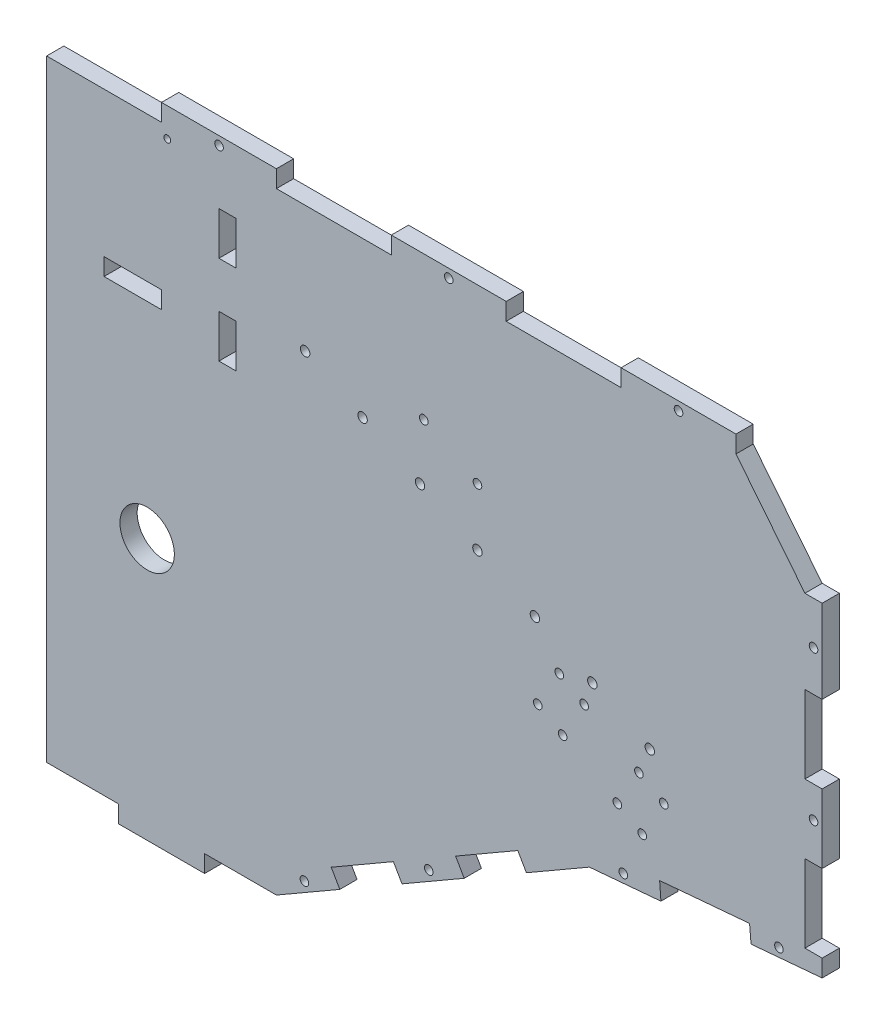
from build123d import *

# Parameters (mm, degrees)
ESQUISSE1_W                   = 270
ESQUISSE1_H                   = 213
BOSS_EXTRU_1_DEPTH            = 6
ESQUISSE3_R                   = 9.475
ESQUISSE3_R_2                 = 1.5
ENL_V_MAT_EXTRU_1_DEPTH       = 10
ENL_V_MAT_EXTRU_11_DEPTH      = 173.055950202
ENL_V_MAT_EXTRU_11_DEPTH_BACK = 173.055950202
ESQUISSE6_W                   = 40
ESQUISSE6_H                   = 6
BOSS_EXTRU_2_DEPTH            = 6
ESQUISSE7_W                   = 6
ESQUISSE7_H                   = 30
ESQUISSE7_H_2                 = 27
ENL_V_MAT_EXTRU_12_DEPTH      = 6
ESQUISSE8_W                   = 30
ESQUISSE8_H                   = 6
BOSS_EXTRU_3_DEPTH            = 6
ENL_V_MAT_EXTRU_13_DEPTH      = 176.833017377
ENL_V_MAT_EXTRU_14_DEPTH      = 10
ESQUISSE11_W                  = 6
ESQUISSE11_H                  = 15
ENL_V_MAT_EXTRU_15_DEPTH      = 176.833017377
ESQUISSE12_R                  = 1.65
ESQUISSE12_R_2                = 1.185214878
ESQUISSE12_R_3                = 1.5
ENL_V_MAT_EXTRU_16_DEPTH      = 176.833017377
ENL_V_MAT_EXTRU_17_DEPTH      = 176.833017377
ESQUISSE14_R                  = 4
ENL_V_MAT_EXTRU_18_DEPTH      = 1
ESQUISSE15_R                  = 2.995
ESQUISSE15_R_2                = 2.95
ENL_V_MAT_EXTRU_19_DEPTH      = 3
ESQUISSE16_R                  = 1.5
ENL_V_MAT_EXTRU_20_DEPTH      = 10
ESQUISSE17_W                  = 20
ESQUISSE17_H                  = 6
ENL_V_MAT_EXTRU_22_DEPTH      = 10


with BuildPart() as part:
    # Esquisse1 → Boss.-Extru.1 (new body)
    with BuildSketch(Plane.XY):
        Rectangle(ESQUISSE1_W, ESQUISSE1_H)
    extrude(amount=BOSS_EXTRU_1_DEPTH)

    # Esquisse3 → Enlèv. mat.-Extru.1 (cut)
    with BuildSketch(Plane.XY.offset(6)):
        with Locations((-100, -21.5)):
            Circle(ESQUISSE3_R)
        with Locations((43.489676576, 9.523710062)):
            Circle(ESQUISSE3_R_2)
        with Locations((52.149930614, 4.523710062)):
            Circle(ESQUISSE3_R_2)
        with Locations((35.989676576, -3.466670994)):
            Circle(ESQUISSE3_R_2)
        with Locations((44.649930614, -8.466670994)):
            Circle(ESQUISSE3_R_2)
        with Locations((63.702489497, -19.466670994)):
            Circle(ESQUISSE3_R_2)
        with Locations((72.362743535, -24.466670994)):
            Circle(ESQUISSE3_R_2)
        with Locations((79.862743535, -11.476289938)):
            Circle(ESQUISSE3_R_2)
        with Locations((71.202489497, -6.476289938)):
            Circle(ESQUISSE3_R_2)
    extrude(amount=-ENL_V_MAT_EXTRU_1_DEPTH, mode=Mode.SUBTRACT)

    # Esquisse5 → Enlèv. mat.-Extru.11 (cut, two sides: drawn at the far end of the back side and taken through both)
    with BuildSketch(Plane.XY.offset(6).offset(-ENL_V_MAT_EXTRU_11_DEPTH_BACK)):
        Polygon((135, -36.5), (53.963742643, -43.589753853), (-55, -106.5), (135, -106.5), align=None)
    extrude(amount=ENL_V_MAT_EXTRU_11_DEPTH + ENL_V_MAT_EXTRU_11_DEPTH_BACK, mode=Mode.SUBTRACT)

    # Esquisse6 → Boss.-Extru.2 (add)
    with BuildSketch(Plane(origin=(0, 106.5, 0), x_dir=(1, 0, 0), z_dir=(0, 1, 0))):
        with Locations((-75, -3)):
            Rectangle(ESQUISSE6_W, ESQUISSE6_H)
        with Locations((5, -3)):
            Rectangle(ESQUISSE6_W, ESQUISSE6_H)
        with Locations((85, -3)):
            Rectangle(ESQUISSE6_W, ESQUISSE6_H)
    extrude(amount=BOSS_EXTRU_2_DEPTH)

    # Esquisse7 → Enlèv. mat.-Extru.12 (cut)
    with BuildSketch(Plane(origin=(0, 0, 0), x_dir=(-1, 0, 0), z_dir=(0, 0, -1))):
        with Locations((-132, 91.5)):
            Rectangle(ESQUISSE7_W, ESQUISSE7_H)
        with Locations((-132, 34)):
            Rectangle(ESQUISSE7_W, ESQUISSE7_H_2)
        with Locations((-132, -17)):
            Rectangle(ESQUISSE7_W, ESQUISSE7_H_2)
    extrude(amount=-ENL_V_MAT_EXTRU_12_DEPTH, mode=Mode.SUBTRACT)

    # Esquisse8 → Boss.-Extru.3 (add)
    with BuildSketch(Plane.XZ.offset(106.5)):
        with Locations((-95, 3)):
            Rectangle(ESQUISSE8_W, ESQUISSE8_H)
    extrude(amount=BOSS_EXTRU_3_DEPTH)

    # Esquisse9 → Enlèv. mat.-Extru.13 (cut, through all)
    with BuildSketch(Plane(origin=(0, 0, 0), x_dir=(-1, 0, 0), z_dir=(0, 0, -1))):
        Polygon((-110.25, -38.665344422), (-109.727065544, -32.688176234), (-78.422975963, -35.411286132), (-78.863742643, -41.411286132), align=None)
    extrude(amount=-ENL_V_MAT_EXTRU_13_DEPTH, mode=Mode.SUBTRACT)

    # Esquisse10 → Enlèv. mat.-Extru.14 (cut)
    with BuildSketch(Plane(origin=(0, 0, 0), x_dir=(-1, 0, 0), z_dir=(0, 0, -1))):
        Polygon((-32.03555308, -56.25), (-10.384917986, -68.75), (-7.384917986, -63.553847577), (-29.03555308, -51.053847577), align=None)
        Polygon((11.265717109, -81.25), (32.916352203, -93.75), (35.916352203, -88.553847577), (14.265717109, -76.053847577), align=None)
    extrude(amount=-ENL_V_MAT_EXTRU_14_DEPTH, mode=Mode.SUBTRACT)

    # Esquisse11 → Enlèv. mat.-Extru.15 (cut, through all)
    with BuildSketch(Plane(origin=(0, 0, 0), x_dir=(-1, 0, 0), z_dir=(0, 0, -1))):
        with Locations((72, 52)):
            Rectangle(ESQUISSE11_W, ESQUISSE11_H)
        with Locations((72, 83)):
            Rectangle(ESQUISSE11_W, ESQUISSE11_H)
    extrude(amount=-ENL_V_MAT_EXTRU_15_DEPTH, mode=Mode.SUBTRACT)

    # Esquisse12 → Enlèv. mat.-Extru.16 (cut, through all)
    with BuildSketch(Plane(origin=(0, 0, 0), x_dir=(-1, 0, 0), z_dir=(0, 0, -1))):
        with Locations((5, 42.5)):
            Circle(ESQUISSE12_R)
        with Locations((-15, 32.5)):
            Circle(ESQUISSE12_R)
        with Locations((-35, 22.5)):
            Circle(ESQUISSE12_R)
        with Locations((-55, 12.5)):
            Circle(ESQUISSE12_R)
        with Locations((-75, 2.5)):
            Circle(ESQUISSE12_R)
        with Locations((25, 52.5)):
            Circle(ESQUISSE12_R)
        with Locations((45, 62.5)):
            Circle(ESQUISSE12_R)
        with Locations((93, 102.5)):
            Circle(ESQUISSE12_R_2)
        with Locations((3.675250237, 62.5)):
            Circle(ESQUISSE12_R_3)
        with Locations((-15, 52.5)):
            Circle(ESQUISSE12_R_3)
    extrude(amount=-ENL_V_MAT_EXTRU_16_DEPTH, mode=Mode.SUBTRACT)

    # Esquisse13 → Enlèv. mat.-Extru.17 (cut, through all)
    with BuildSketch(Plane(origin=(0, 0, 0), x_dir=(-1, 0, 0), z_dir=(0, 0, -1))):
        Polygon((-129, 76.5), (-129, 106.5), (-105, 106.5), align=None)
    extrude(amount=-ENL_V_MAT_EXTRU_17_DEPTH, mode=Mode.SUBTRACT)

    # Esquisse14 → Enlèv. mat.-Extru.18 (cut)
    with BuildSketch(Plane(origin=(0, 0, 0), x_dir=(-1, 0, 0), z_dir=(0, 0, -1))):
        with Locations((-75, 2.5)):
            Circle(ESQUISSE14_R)
        with Locations((-55, 12.5)):
            Circle(ESQUISSE14_R)
        with Locations((-35, 22.5)):
            Circle(ESQUISSE14_R)
        with Locations((-15, 32.5)):
            Circle(ESQUISSE14_R)
        with Locations((5, 42.5)):
            Circle(ESQUISSE14_R)
        with Locations((25, 52.5)):
            Circle(ESQUISSE14_R)
        with Locations((45, 62.5)):
            Circle(ESQUISSE14_R)
    extrude(amount=-ENL_V_MAT_EXTRU_18_DEPTH, mode=Mode.SUBTRACT)

    # Esquisse15 → Enlèv. mat.-Extru.19 (cut)
    with BuildSketch(Plane(origin=(0, 0, 0), x_dir=(-1, 0, 0), z_dir=(0, 0, -1))):
        with Locations((-85, 109.5)):
            Circle(ESQUISSE15_R)
        with Locations((-5, 109.5)):
            Circle(ESQUISSE15_R)
        with Locations((75, 109.5)):
            Circle(ESQUISSE15_R)
        with Locations((1.940399562, -72.401923789)):
            Circle(ESQUISSE15_R)
        with Locations((-65.76712105, -39.571035308)):
            Circle(ESQUISSE15_R)
        with Locations((45.241669751, -97.401923789)):
            Circle(ESQUISSE15_R_2)
        with Locations((-132, 9.551106058)):
            Circle(ESQUISSE15_R)
        with Locations((-132, 61.579483335)):
            Circle(ESQUISSE15_R)
        with Locations((-119.950479753, -34.805202901)):
            Circle(ESQUISSE15_R)
    extrude(amount=-ENL_V_MAT_EXTRU_19_DEPTH, mode=Mode.SUBTRACT)

    # Esquisse16 → Enlèv. mat.-Extru.20 (cut)
    with BuildSketch(Plane(origin=(0, 0, 0), x_dir=(-1, 0, 0), z_dir=(0, 0, -1))):
        with Locations((-5, 109.5)):
            Circle(ESQUISSE16_R)
        with Locations((74.967795866, 109.5)):
            Circle(ESQUISSE16_R)
        with Locations((-85, 109.5)):
            Circle(ESQUISSE16_R)
        with Locations((-132, 61.579483335)):
            Circle(ESQUISSE16_R)
        with Locations((-132, 9.551106058)):
            Circle(ESQUISSE16_R)
        with Locations((-119.950479753, -34.805202901)):
            Circle(ESQUISSE16_R)
        with Locations((-65.76712105, -39.571035308)):
            Circle(ESQUISSE16_R)
        with Locations((1.940399562, -72.401923789)):
            Circle(ESQUISSE16_R)
        with Locations((45.241669751, -97.401923789)):
            Circle(ESQUISSE16_R)
    extrude(amount=-ENL_V_MAT_EXTRU_20_DEPTH, mode=Mode.SUBTRACT)

    # Esquisse17 → Enlèv. mat.-Extru.22 (cut)
    with BuildSketch(Plane(origin=(0, 0, 0), x_dir=(-1, 0, 0), z_dir=(0, 0, -1))):
        with Locations((105, 53)):
            Rectangle(ESQUISSE17_W, ESQUISSE17_H)
    extrude(amount=-ENL_V_MAT_EXTRU_22_DEPTH, mode=Mode.SUBTRACT)


solid = part.part
